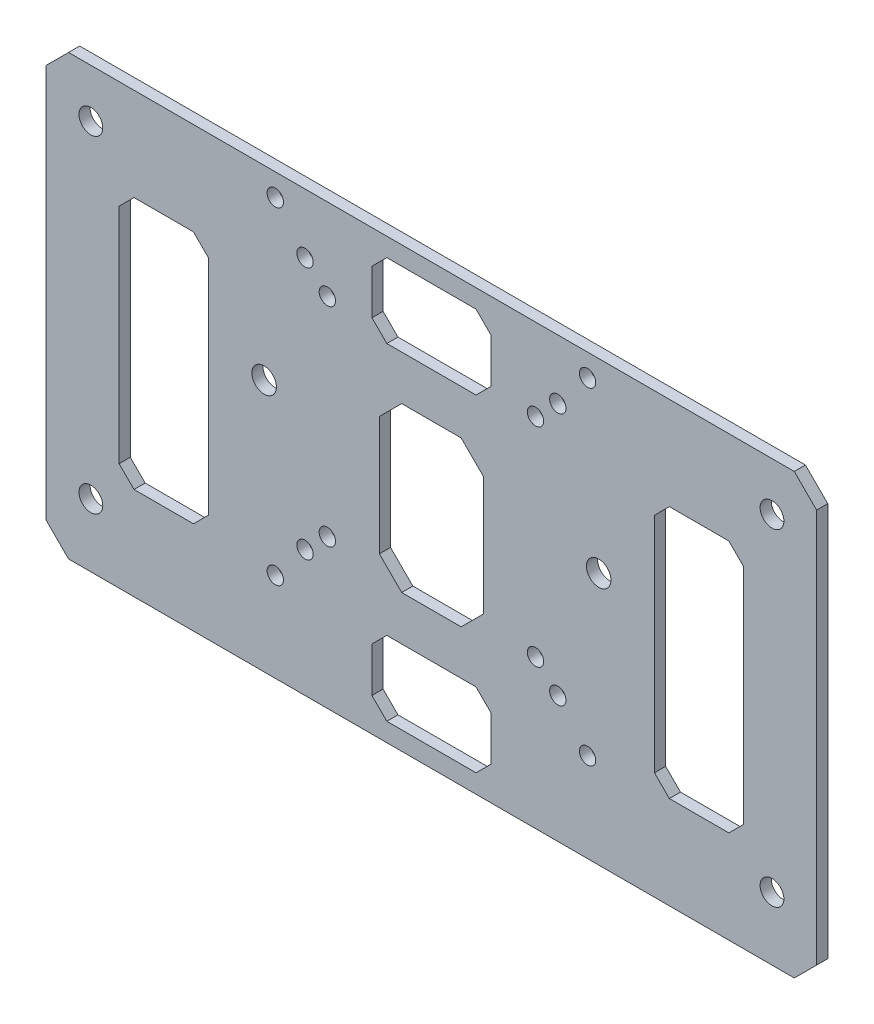
from build123d import *

# Parameters (mm, degrees)
SKETCH_1_R    = 1.6
SKETCH_1_R_2  = 1.1
SKETCH_1_R_3  = 1.65
F_1P5MM_DEPTH = 1.5
SKETCH_2_R    = 1.1
D2P2_DEPTH    = 1.5


with BuildPart() as part:
    # 草图1 → 1p5mm竖向开孔板_上下四孔 (new body)
    with BuildSketch(Plane.XY):
        Polygon((-48.804040507, -9), (48.804040507, -9), (51.804040507, -6), (51.804040507, 47), (48.804040507, 50), (-48.804040507, 50), (-51.804040507, 47), (-51.804040507, -6), align=None)
        with Locations((-45.804040507, -0.5)):
            Circle(SKETCH_1_R, mode=Mode.SUBTRACT)
        with Locations((-45.804040507, 43.5)):
            Circle(SKETCH_1_R, mode=Mode.SUBTRACT)
        with Locations((45.804040507, -0.5)):
            Circle(SKETCH_1_R, mode=Mode.SUBTRACT)
        with Locations((45.804040507, 43.5)):
            Circle(SKETCH_1_R, mode=Mode.SUBTRACT)
        with Locations((-21, 3)):
            Circle(SKETCH_1_R_2, mode=Mode.SUBTRACT)
        with Locations((21, 3)):
            Circle(SKETCH_1_R_2, mode=Mode.SUBTRACT)
        with Locations((-14, 11)):
            Circle(SKETCH_1_R_2, mode=Mode.SUBTRACT)
        with Locations((-14, 39)):
            Circle(SKETCH_1_R_2, mode=Mode.SUBTRACT)
        with Locations((14, 11)):
            Circle(SKETCH_1_R_2, mode=Mode.SUBTRACT)
        with Locations((14, 39)):
            Circle(SKETCH_1_R_2, mode=Mode.SUBTRACT)
        with Locations((-17, 8)):
            Circle(SKETCH_1_R_2, mode=Mode.SUBTRACT)
        with Locations((-17, 42)):
            Circle(SKETCH_1_R_2, mode=Mode.SUBTRACT)
        with Locations((17, 8)):
            Circle(SKETCH_1_R_2, mode=Mode.SUBTRACT)
        with Locations((17, 42)):
            Circle(SKETCH_1_R_2, mode=Mode.SUBTRACT)
        with Locations((-22.5, 25)):
            Circle(SKETCH_1_R_3, mode=Mode.SUBTRACT)
        with Locations((22.5, 25)):
            Circle(SKETCH_1_R_3, mode=Mode.SUBTRACT)
        Polygon((-4, 9.5), (4, 9.5), (7, 12.5), (7, 28.5), (4, 31.5), (-4, 31.5), (-7, 28.5), (-7, 12.5), align=None, mode=Mode.SUBTRACT)
        Polygon((-40, 3.5), (-32, 3.5), (-30, 5.5), (-30, 35.5), (-32, 37.5), (-40, 37.5), (-42, 35.5), (-42, 5.5), align=None, mode=Mode.SUBTRACT)
        Polygon((32, 3.5), (40, 3.5), (42, 5.5), (42, 35.5), (40, 37.5), (32, 37.5), (30, 35.5), (30, 5.5), align=None, mode=Mode.SUBTRACT)
        Polygon((-6, -6.5), (6, -6.5), (8, -4.5), (8, 1.5), (6, 3.5), (-6, 3.5), (-8, 1.5), (-8, -4.5), align=None, mode=Mode.SUBTRACT)
        Polygon((-6, 37.5), (6, 37.5), (8, 39.5), (8, 45.5), (6, 47.5), (-6, 47.5), (-8, 45.5), (-8, 39.5), align=None, mode=Mode.SUBTRACT)
    extrude(amount=F_1P5MM_DEPTH)

    # 草图2 → 上沿电池板钢索孔_D2p2 (cut)
    with BuildSketch(Plane.XY):
        with Locations((-21, 47)):
            Circle(SKETCH_2_R)
        with Locations((21, 47)):
            Circle(SKETCH_2_R)
    extrude(amount=D2P2_DEPTH, mode=Mode.SUBTRACT)


solid = part.part
